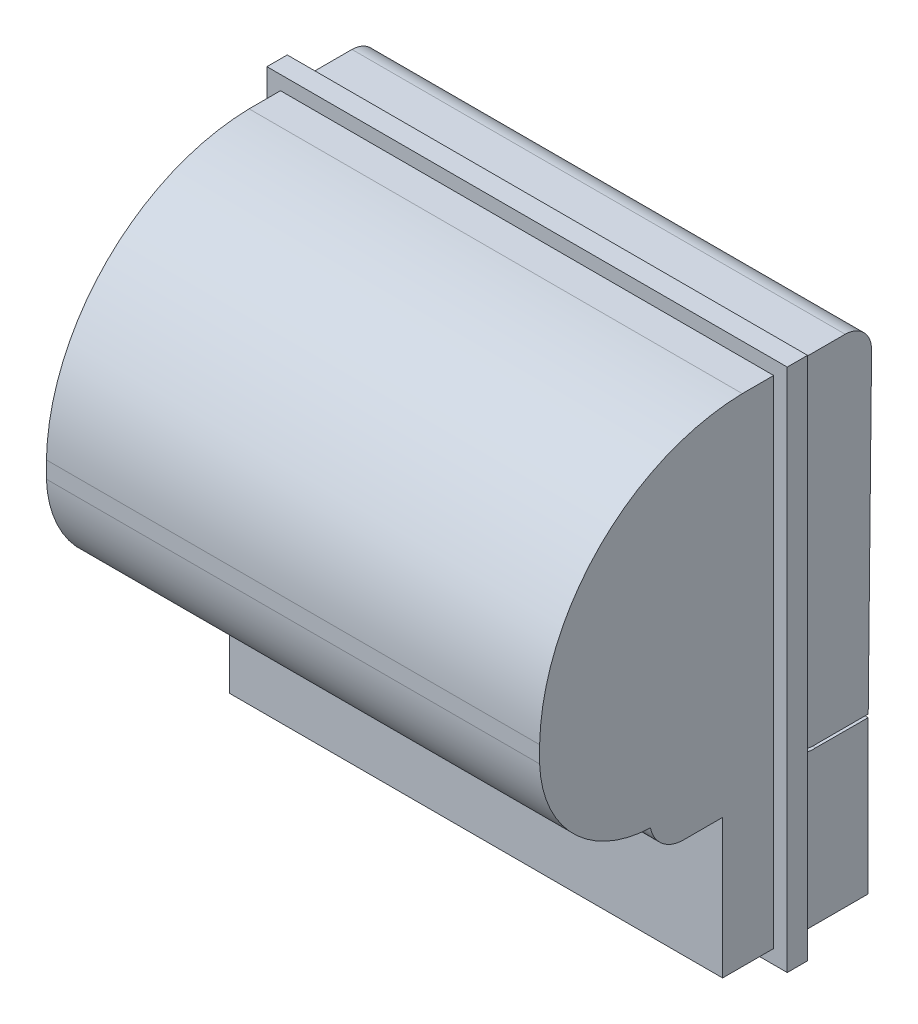
from build123d import *

# Parameters (mm, degrees)
SKETCH1_W                       = 76.8
SKETCH1_H                       = 77.4
SKETCH1_W_2                     = 72.8
SKETCH1_H_2                     = 73.25
BOSS_EXTRUDE1_DEPTH             = 3
BOSS_EXTRUDE2_REACH             = 88.454
BOSS_EXTRUDE2_DIRECTION_2_REACH = 88.454
CUT_EXTRUDE1_DEPTH              = 36.5
CUT_EXTRUDE1_DEPTH_BACK         = 36.5


with BuildPart() as part:
    # Sketch1 → Boss-Extrude1 (new body)
    with BuildSketch(Plane.XY):
        with Locations((38.4, 38.7)):
            Rectangle(SKETCH1_W, SKETCH1_H)
        with Locations((38.4, 38.7)):
            Rectangle(SKETCH1_W_2, SKETCH1_H_2, mode=Mode.SUBTRACT)
    extrude(amount=BOSS_EXTRUDE1_DEPTH)

    # Boss-Extrude2: up to this face of the body (flat: up to its plane)
    boss_extrude2_end = Plane(part.part.faces().sort_by_distance((2, 38.7, 1.5))[0])
    # Sketch3 → Boss-Extrude2 (add, up to the picked face)
    with BuildSketch(Plane.ZY.offset(-38.4), mode=Mode.PRIVATE) as boss_extrude2_sk1:
        Polygon((3, 75.325), (37.55, 75.325), (37.55, 2.075), (3, 2.075), (-11.45, 2.075), (-11.45, 75.325), align=None)
    boss_extrude2_tool1 = split(extrude(boss_extrude2_sk1.sketch, amount=BOSS_EXTRUDE2_REACH, mode=Mode.PRIVATE), bisect_by=boss_extrude2_end, keep=Keep.BOTH, mode=Mode.PRIVATE)
    add(boss_extrude2_tool1.solids().sort_by(Axis((38.4, 38.7, 13.05), (-1, 0, 0)))[0])

    # Boss-Extrude2 direction 2: up to this face of the body (flat: up to its plane)
    boss_extrude2_direction_2_end = Plane(part.part.faces().sort_by_distance((74.8, 38.7, 1.5))[0])
    # Sketch3 → Boss-Extrude2 direction 2 (add, up to the picked face)
    with BuildSketch(Plane.ZY.offset(-38.4), mode=Mode.PRIVATE) as boss_extrude2_direction_2_sk1:
        Polygon((3, 75.325), (37.55, 75.325), (37.55, 2.075), (3, 2.075), (-11.45, 2.075), (-11.45, 75.325), align=None)
    boss_extrude2_direction_2_tool1 = split(extrude(boss_extrude2_direction_2_sk1.sketch, amount=-BOSS_EXTRUDE2_DIRECTION_2_REACH, mode=Mode.PRIVATE), bisect_by=boss_extrude2_direction_2_end, keep=Keep.BOTH, mode=Mode.PRIVATE)
    add(boss_extrude2_direction_2_tool1.solids().sort_by(Axis((38.4, 38.7, 13.05), (1, 0, 0)))[0])

    # Sketch4 → Cut-Extrude1 (cut, two sides: drawn at the far end of the back side and taken through both)
    with BuildSketch(Plane.ZY.offset(-38.4).offset(-CUT_EXTRUDE1_DEPTH_BACK)):
        with BuildLine():
            Line((-10.95, 25.069274624), (-11.45, 71.427579202))
            Line((-11.45, 71.427579202), (-11.45, 2.075))
            Line((-11.45, 2.075), (-10.95, 2.075))
            Line((-10.95, 2.075), (-10.95, 24.615051172))
            Line((-10.95, 24.615051172), (-3.159893594, 24.634539463))
            ThreePointArc((-3.159893594, 24.634539463), (-1.063252525, 25.227514391), (0, 27.129360101))
            Line((0, 27.129360101), (0, 27.629360101))
            ThreePointArc((0, 27.629360101), (-1.049735735, 25.694881971), (-3.159893594, 25.069274624))
            Line((-3.159893594, 25.069274624), (-10.95, 25.069274624))
        make_face()
        with BuildLine():
            ThreePointArc((-7.449766555, 75.325), (-7.501172879, 75.325334593), (-7.552579202, 75.325))
            Line((-7.552579202, 75.325), (-7.449766555, 75.325))
        make_face()
        with BuildLine():
            Line((-11.45, 75.325), (-11.45, 71.427579202))
            ThreePointArc((-11.45, 71.427579202), (-10.293651907, 74.168651907), (-7.552579202, 75.325))
            Line((-7.552579202, 75.325), (-11.45, 75.325))
        make_face()
        with BuildLine():
            ThreePointArc((21.195514184, 26.59148761), (19.445162982, 23.729233412), (16.282917728, 22.60832602))
            Line((16.282917728, 22.60832602), (10.540023281, 22.60832602))
            Line((10.540023281, 22.60832602), (10.540023281, 2.075))
            Line((10.540023281, 2.075), (37.55, 2.075))
            Line((37.55, 2.075), (37.55, 42.945973427))
            ThreePointArc((37.55, 42.945973427), (32.588948731, 31.55253888), (21.195514184, 26.59148761))
        make_face()
        with BuildLine():
            ThreePointArc((7.633980307, 75.325), (28.610259758, 66.385259758), (37.55, 45.408980307))
            Line((37.55, 45.408980307), (37.55, 75.325))
            Line((37.55, 75.325), (7.633980307, 75.325))
        make_face()
        with BuildLine():
            Line((37.55, 45.408980307), (37.55, 44.16612845))
            ThreePointArc((37.55, 44.16612845), (37.556322242, 44.787554379), (37.55, 45.408980307))
        make_face()
        with BuildLine():
            Line((37.55, 44.16612845), (37.55, 42.945973427))
            ThreePointArc((37.55, 42.945973427), (37.560966221, 43.556050938), (37.55, 44.16612845))
        make_face()
    extrude(amount=CUT_EXTRUDE1_DEPTH + CUT_EXTRUDE1_DEPTH_BACK, mode=Mode.SUBTRACT)


solid = part.part
